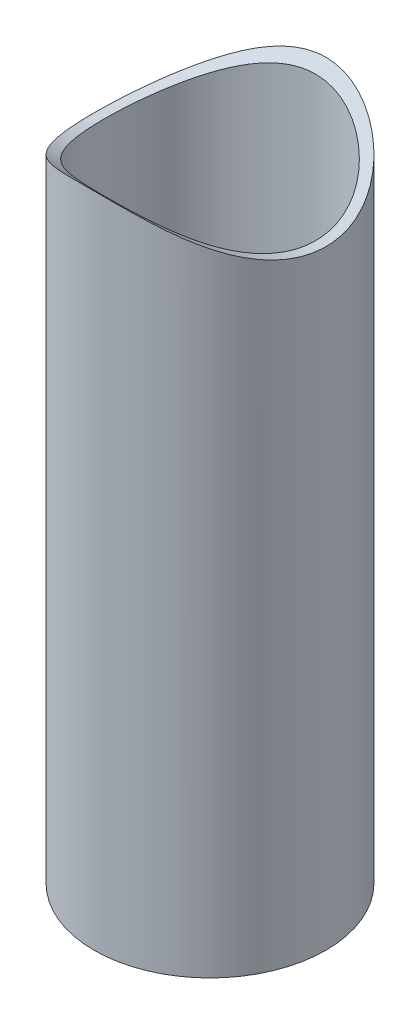
from build123d import *

# Parameters (mm, degrees)
SKETCH1_R           = 11.25
SKETCH1_R_2         = 10.25
BOSS_EXTRUDE1_DEPTH = 75
SKETCH3_R           = 15.875


with BuildPart() as part:
    # Sketch1 → Boss-Extrude1 (new body)
    with BuildSketch(Plane(origin=(0, 0, 0), x_dir=(1, 0, 0), z_dir=(0, 1, 0))):
        with Locations(Location((0, 0, 0), (0, 0, 270))):
            Circle(SKETCH1_R)
        with Locations(Location((0, 0, 0), (0, 0, 270))):
            Circle(SKETCH1_R_2, mode=Mode.SUBTRACT)
    extrude(amount=BOSS_EXTRUDE1_DEPTH)

    # Cut-Sweep1: sweep along a path in Sketch2
    with BuildLine(Plane.XY) as cut_sweep1_path:
        Line((-75.458123022, 75), (31.147702825, 75))
    # Sketch3 → Cut-Sweep1 (sweep, cut)
    with BuildSketch(Plane(origin=(31.147702825, 75, 0), x_dir=(0, -1, 0), z_dir=(1, 0, 0))):
        Circle(SKETCH3_R)
    sweep(path=cut_sweep1_path.line, mode=Mode.SUBTRACT)


solid = part.part
